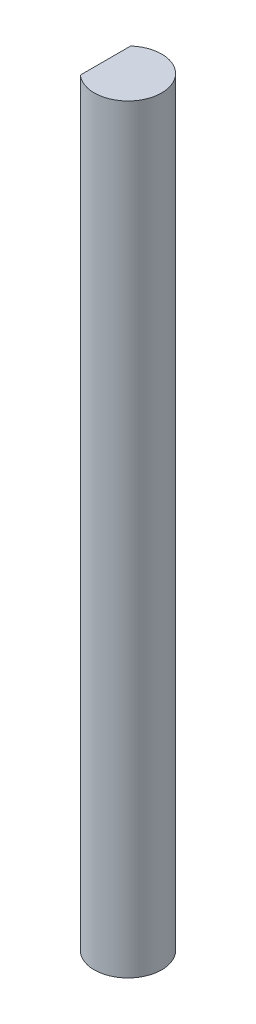
from build123d import *

# Parameters (mm, degrees)
EXTRUDE_1_DEPTH = 33.8


with BuildPart() as part:
    # 草图4 → 凸台-拉伸1 (new body)
    with BuildSketch(Plane(origin=(0, 0, 0), x_dir=(1, 0, 0), z_dir=(0, 1, 0))):
        with BuildLine():
            ThreePointArc((1.5, 0), (0.612372436, 1.369306394), (-1, 1.118033989))
            Line((-1, 1.118033989), (-1, -1.118033989))
            ThreePointArc((-1, -1.118033989), (0.612372436, -1.369306394), (1.5, 0))
        make_face()
    extrude(amount=EXTRUDE_1_DEPTH)


solid = part.part
